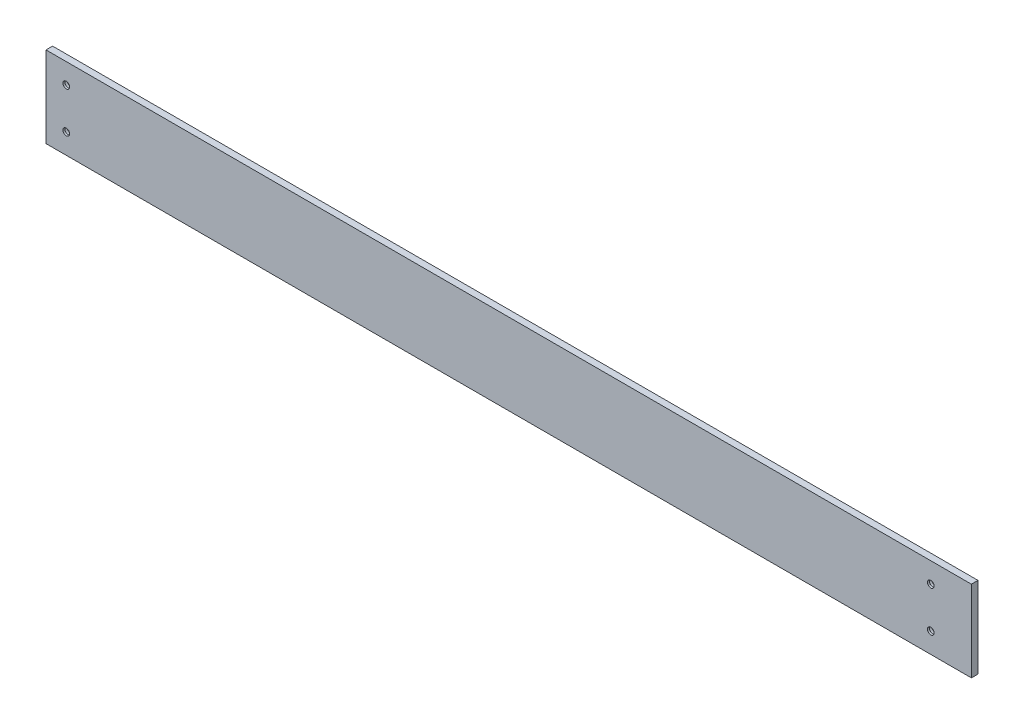
from build123d import *

# Parameters (mm, degrees)
ESQUISSE1_W                                = 912
ESQUISSE1_H                                = 80
BOSS_EXTRU_1_DEPTH                         = 6.5
D_GAGEMENT_M61_D                           = 6.6
CHAMBRAGE_POUR_VIS_T_TE_RONDE_BOMB_2_COUNT = 2
CHAMBRAGE_POUR_VIS_T_TE_RONDE_BOMB_2_PITCH = 40
R_P_TITION_LIN_AIRE1_COUNT                 = 2
R_P_TITION_LIN_AIRE1_PITCH                 = 852


with BuildPart() as part:
    # Esquisse1 → Boss.-Extru.1 (new body)
    with BuildSketch(Plane.XY):
        Rectangle(ESQUISSE1_W, ESQUISSE1_H)
    extrude(amount=BOSS_EXTRU_1_DEPTH)

    # Dégagement M61 (through all)
    with Locations(Plane.XY.offset(6.5)):
        with Locations((-436, 20), (-436, -20)):
            Hole(D_GAGEMENT_M61_D / 2)

    # Esquisse4 → Chambrage pour vis à tête ronde bombée M61 (revolve, cut)
    with BuildSketch(Plane(origin=(-436, 20, 0), x_dir=(0, 1, 0), z_dir=(1, 0, 0))):
        Polygon((0, 0), (0, 6.5), (3.3, 6.5), (3.3, 4.625), (3.325, 4.6), (6.5, 4.6), (6.5, 0), align=None)
    chambrage_pour_vis_t_te_ronde_bomb_e_m = revolve(axis=Axis((-436, 20, -6.35), (0, 0, 1)), mode=Mode.SUBTRACT)

    # Chambrage pour vis _ t_te ronde bomb 2: Chambrage pour vis à tête ronde bombée M61 ×2
    with Locations(*[(0, -i * CHAMBRAGE_POUR_VIS_T_TE_RONDE_BOMB_2_PITCH, 0) for i in range(1, CHAMBRAGE_POUR_VIS_T_TE_RONDE_BOMB_2_COUNT)]):
        add(chambrage_pour_vis_t_te_ronde_bomb_e_m, mode=Mode.SUBTRACT)

    # Répétition linéaire1: Chambrage pour vis à tête ronde bombée M61 ×2
    with Locations(*[(i * R_P_TITION_LIN_AIRE1_PITCH, 0, 0) for i in range(1, R_P_TITION_LIN_AIRE1_COUNT)]):
        add(chambrage_pour_vis_t_te_ronde_bomb_e_m, mode=Mode.SUBTRACT)

    # Répétition linéaire1 copy 1 sketch → Répétition linéaire1 copy 1 (revolve, cut)
    with BuildSketch(Plane(origin=(416, -20, 0), x_dir=(0, 1, 0), z_dir=(1, 0, 0))):
        Polygon((0, 0), (0, 6.5), (3.3, 6.5), (3.3, 4.625), (3.325, 4.6), (6.5, 4.6), (6.5, 0), align=None)
    revolve(axis=Axis((416, -20, -6.35), (0, 0, 1)), mode=Mode.SUBTRACT)


solid = part.part
